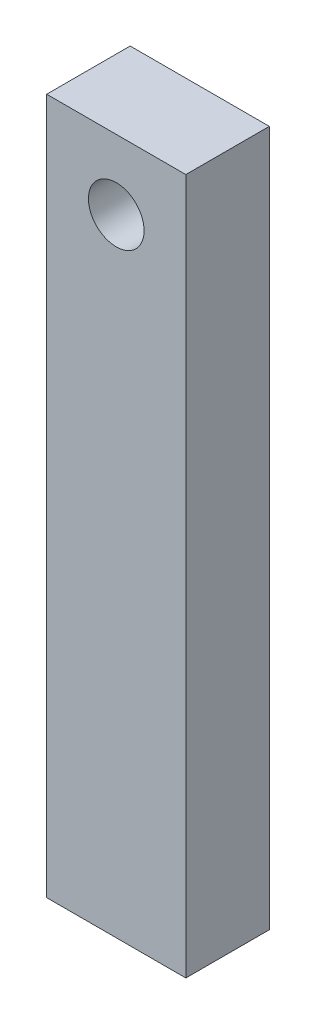
from build123d import *

# Parameters (mm, degrees)
ESBO_O1_W                = 10
ESBO_O1_H                = 50
RESSALTO_EXTRUS_O1_DEPTH = 6
ESBO_O2_R                = 2
CORTE_EXTRUS_O1_DEPTH    = 51.658902179


with BuildPart() as part:
    # Esboço1 → Ressalto-extrusão1 (new body)
    with BuildSketch(Plane.XY):
        with Locations((-0.506756757, 25)):
            Rectangle(ESBO_O1_W, ESBO_O1_H)
    extrude(amount=RESSALTO_EXTRUS_O1_DEPTH)

    # Esboço2 → Corte-extrusão1 (cut, through all)
    with BuildSketch(Plane.XY.offset(6)):
        with Locations((-0.506756757, 45)):
            Circle(ESBO_O2_R)
    extrude(amount=-CORTE_EXTRUS_O1_DEPTH, mode=Mode.SUBTRACT)


solid = part.part
